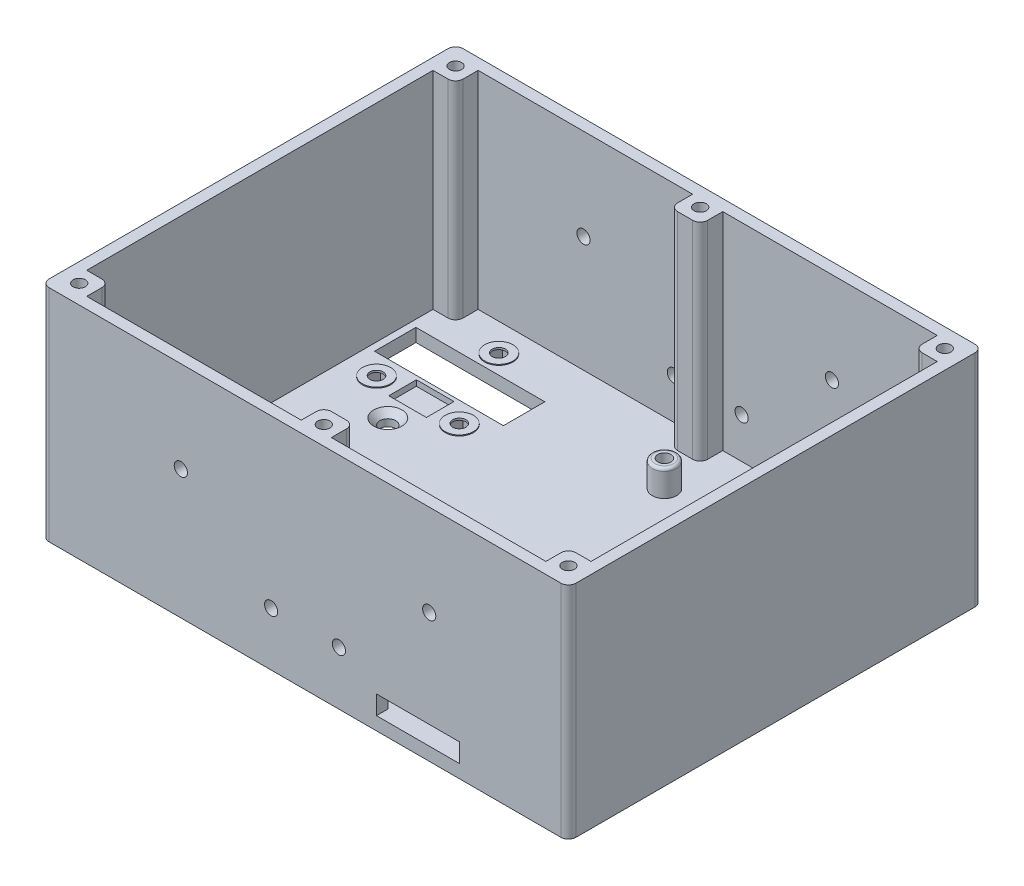
from build123d import *

# Parameters (mm, degrees)
SKETCH1_W                             = 140
SKETCH1_H                             = 110
BOTTOM_DEPTH                          = 3.5
SKETCH3_W                             = 140
SKETCH3_H                             = 110
WALL_DEPTH                            = 55
SKETCH4_R                             = 1.625
TOP_PLATE_SCREW_HOLES_DEPTH           = 30
TOP_PLATE_SCREW_HOLES_DRAFT           = -1
TOP_PLATE_SCREW_HOLES_PROFILE_2_DEPTH = 30
TOP_PLATE_SCREW_HOLES_PROFILE_2_DRAFT = -1
TOP_PLATE_SCREW_HOLES_PROFILE_3_DEPTH = 30
TOP_PLATE_SCREW_HOLES_PROFILE_3_DRAFT = -1
TOP_PLATE_SCREW_HOLES_PROFILE_4_DEPTH = 30
TOP_PLATE_SCREW_HOLES_PROFILE_4_DRAFT = -1
TOP_PLATE_SCREW_HOLES_PROFILE_5_DEPTH = 30
TOP_PLATE_SCREW_HOLES_PROFILE_5_DRAFT = -1
TOP_PLATE_SCREW_HOLES_PROFILE_6_DEPTH = 30
TOP_PLATE_SCREW_HOLES_PROFILE_6_DRAFT = -1
FILLET14_R                            = 2
FILLET13_R                            = 2
FILLET12_R                            = 2
FILLET11_R                            = 2
FILLET1_R                             = 2
FILLET2_R                             = 2
FILLET3_R                             = 2
FILLET4_R                             = 2
FILLET5_R                             = 2
FILLET6_R                             = 2
FILLET7_R                             = 2
FILLET8_R                             = 2
M4_MOUNT_R                            = 2.1
M4_MOUNT_CUT_DEPTH                    = 105.642247682
SKETCH7_R                             = 7.5
USB_CABEL_CUT_DEPTH                   = 107.523471592
FILLET9_R                             = 1
FILLET10_R                            = 1
SKETCH14_W                            = 8
SKETCH14_H                            = 7
BOSS_EXTRUDE1_DEPTH                   = 6
SKETCH16_W                            = 4
SKETCH16_H                            = 3
CUT_EXTRUDE6_DEPTH                    = 7
SKETCH9_R                             = 3.25
CURCUIT_BOARD_MOUNT_POSTS_EXT_DEPTH   = 7
SKETCH10_R                            = 1.75
M3_SCREW_CURCUIT_MOUNT_CUT_DEPTH      = 102.138518874
M3_HEAD_CIRCUIT_MOUNT_CUT_DEPTH       = 3.25
FILLET15_R                            = 0.75
FILLET16_R                            = 0.75
SKETCH18_R                            = 1.75
TOP_SCREW_DEPTH                       = 3
SKETCH19_W                            = 22
SKETCH19_H                            = 5
TOP_CABLES_DEPTH                      = 10
SKETCH20_W                            = 22
SKETCH20_H                            = 5
BOTTOM_CABLES_DEPTH                   = 3
BOTTOM_SCREW_START                    = -3
SKETCH21_R                            = 1.75
BOTTOM_SCREW_DEPTH                    = 3
SKETCH22_W                            = 34.25
SKETCH22_H                            = 11
CONNECTORS_CUT_DEPTH                  = 3.5
SKETCH24_R                            = 3.75
STANDOFFS_DEPTH                       = 0.25
M3_SCREW_HOLE_DEPTH                   = 105.642247682
M3_SCREW_HOLE_DEPTH_BACK              = 105.642247682
SKETCH23_R                            = 1.75
M3_NUT_DEPTH                          = 3.25
SKETCH26_W                            = 10
SKETCH26_H                            = 7.35
ROOM_FOR_PCB_PINS_DEPTH               = 1.5


with BuildPart() as part:
    # Sketch1 → Bottom (new body)
    with BuildSketch(Plane(origin=(0, 0, 0), x_dir=(1, 0, 0), z_dir=(0, 1, 0))):
        Rectangle(SKETCH1_W, SKETCH1_H)
    extrude(amount=BOTTOM_DEPTH)

    # Sketch3 → Wall (add)
    with BuildSketch(Plane(origin=(0, 3.5, 0), x_dir=(1, 0, 0), z_dir=(0, 1, 0))):
        Rectangle(SKETCH3_W, SKETCH3_H)
        Polygon((-61, 52), (-4, 52), (-4, 46), (4, 46), (4, 52), (61, 52), (61, 46), (67, 46), (67, -46), (61, -46), (61, -52), (4, -52), (4, -46), (-4, -46), (-4, -52), (-61, -52), (-61, -46), (-67, -46), (-67, 46), (-61, 46), align=None, mode=Mode.SUBTRACT)
    extrude(amount=WALL_DEPTH)


with BuildPart() as top_plate_screw_holes_tool:
    # Sketch4 → Top Plate Screw Holes (with draft: the straight prism first)
    with BuildSketch(Plane(origin=(0, 58.5, 0), x_dir=(1, 0, 0), z_dir=(0, 1, 0))):
        with Locations((-65, 50)):
            Circle(SKETCH4_R)
    extrude(amount=-TOP_PLATE_SCREW_HOLES_DEPTH)
    # Top Plate Screw Holes: the draft: its side faces are tilted about the plane it starts from
    top_plate_screw_holes_sides = [top_plate_screw_holes_tool.faces().sort_by_distance(p)[0] for p in [
        (-66.625, 43.5, -50),
    ]]
    draft(top_plate_screw_holes_sides, Plane(origin=(0, 58.5, 0), x_dir=(1, 0, 0), z_dir=(0, 1, 0)), TOP_PLATE_SCREW_HOLES_DRAFT)


with BuildPart() as part_1:
    add(part.part)

    # Top Plate Screw Holes: cut by top_plate_screw_holes_tool
    add(top_plate_screw_holes_tool.part, mode=Mode.SUBTRACT)


with BuildPart() as top_plate_screw_holes_profile_2_tool:
    # Sketch4 → Top Plate Screw Holes profile 2 (with draft: the straight prism first)
    with BuildSketch(Plane(origin=(0, 58.5, 0), x_dir=(1, 0, 0), z_dir=(0, 1, 0))):
        with Locations((65, 50)):
            Circle(SKETCH4_R)
    extrude(amount=-TOP_PLATE_SCREW_HOLES_PROFILE_2_DEPTH)
    # Top Plate Screw Holes profile 2: the draft: its side faces are tilted about the plane it starts from
    top_plate_screw_holes_profile_2_sides = [top_plate_screw_holes_profile_2_tool.faces().sort_by_distance(p)[0] for p in [
        (63.375, 43.5, -50),
    ]]
    draft(top_plate_screw_holes_profile_2_sides, Plane(origin=(0, 58.5, 0), x_dir=(1, 0, 0), z_dir=(0, 1, 0)), TOP_PLATE_SCREW_HOLES_PROFILE_2_DRAFT)


with BuildPart() as part_2:
    add(part_1.part)

    # Top Plate Screw Holes profile 2: cut by top_plate_screw_holes_profile_2_tool
    add(top_plate_screw_holes_profile_2_tool.part, mode=Mode.SUBTRACT)


with BuildPart() as top_plate_screw_holes_profile_3_tool:
    # Sketch4 → Top Plate Screw Holes profile 3 (with draft: the straight prism first)
    with BuildSketch(Plane(origin=(0, 58.5, 0), x_dir=(1, 0, 0), z_dir=(0, 1, 0))):
        with Locations((65, -50)):
            Circle(SKETCH4_R)
    extrude(amount=-TOP_PLATE_SCREW_HOLES_PROFILE_3_DEPTH)
    # Top Plate Screw Holes profile 3: the draft: its side faces are tilted about the plane it starts from
    top_plate_screw_holes_profile_3_sides = [top_plate_screw_holes_profile_3_tool.faces().sort_by_distance(p)[0] for p in [
        (63.375, 43.5, 50),
    ]]
    draft(top_plate_screw_holes_profile_3_sides, Plane(origin=(0, 58.5, 0), x_dir=(1, 0, 0), z_dir=(0, 1, 0)), TOP_PLATE_SCREW_HOLES_PROFILE_3_DRAFT)


with BuildPart() as part_3:
    add(part_2.part)

    # Top Plate Screw Holes profile 3: cut by top_plate_screw_holes_profile_3_tool
    add(top_plate_screw_holes_profile_3_tool.part, mode=Mode.SUBTRACT)


with BuildPart() as top_plate_screw_holes_profile_4_tool:
    # Sketch4 → Top Plate Screw Holes profile 4 (with draft: the straight prism first)
    with BuildSketch(Plane(origin=(0, 58.5, 0), x_dir=(1, 0, 0), z_dir=(0, 1, 0))):
        with Locations((-65, -50)):
            Circle(SKETCH4_R)
    extrude(amount=-TOP_PLATE_SCREW_HOLES_PROFILE_4_DEPTH)
    # Top Plate Screw Holes profile 4: the draft: its side faces are tilted about the plane it starts from
    top_plate_screw_holes_profile_4_sides = [top_plate_screw_holes_profile_4_tool.faces().sort_by_distance(p)[0] for p in [
        (-66.625, 43.5, 50),
    ]]
    draft(top_plate_screw_holes_profile_4_sides, Plane(origin=(0, 58.5, 0), x_dir=(1, 0, 0), z_dir=(0, 1, 0)), TOP_PLATE_SCREW_HOLES_PROFILE_4_DRAFT)


with BuildPart() as part_4:
    add(part_3.part)

    # Top Plate Screw Holes profile 4: cut by top_plate_screw_holes_profile_4_tool
    add(top_plate_screw_holes_profile_4_tool.part, mode=Mode.SUBTRACT)


with BuildPart() as top_plate_screw_holes_profile_5_tool:
    # Sketch4 → Top Plate Screw Holes profile 5 (with draft: the straight prism first)
    with BuildSketch(Plane(origin=(0, 58.5, 0), x_dir=(1, 0, 0), z_dir=(0, 1, 0))):
        with Locations((0, 50)):
            Circle(SKETCH4_R)
    extrude(amount=-TOP_PLATE_SCREW_HOLES_PROFILE_5_DEPTH)
    # Top Plate Screw Holes profile 5: the draft: its side faces are tilted about the plane it starts from
    top_plate_screw_holes_profile_5_sides = [top_plate_screw_holes_profile_5_tool.faces().sort_by_distance(p)[0] for p in [
        (-1.625, 43.5, -50),
    ]]
    draft(top_plate_screw_holes_profile_5_sides, Plane(origin=(0, 58.5, 0), x_dir=(1, 0, 0), z_dir=(0, 1, 0)), TOP_PLATE_SCREW_HOLES_PROFILE_5_DRAFT)


with BuildPart() as part_5:
    add(part_4.part)

    # Top Plate Screw Holes profile 5: cut by top_plate_screw_holes_profile_5_tool
    add(top_plate_screw_holes_profile_5_tool.part, mode=Mode.SUBTRACT)


with BuildPart() as top_plate_screw_holes_profile_6_tool:
    # Sketch4 → Top Plate Screw Holes profile 6 (with draft: the straight prism first)
    with BuildSketch(Plane(origin=(0, 58.5, 0), x_dir=(1, 0, 0), z_dir=(0, 1, 0))):
        with Locations((0, -50)):
            Circle(SKETCH4_R)
    extrude(amount=-TOP_PLATE_SCREW_HOLES_PROFILE_6_DEPTH)
    # Top Plate Screw Holes profile 6: the draft: its side faces are tilted about the plane it starts from
    top_plate_screw_holes_profile_6_sides = [top_plate_screw_holes_profile_6_tool.faces().sort_by_distance(p)[0] for p in [
        (-1.625, 43.5, 50),
    ]]
    draft(top_plate_screw_holes_profile_6_sides, Plane(origin=(0, 58.5, 0), x_dir=(1, 0, 0), z_dir=(0, 1, 0)), TOP_PLATE_SCREW_HOLES_PROFILE_6_DRAFT)


with BuildPart() as part_6:
    add(part_5.part)

    # Top Plate Screw Holes profile 6: cut by top_plate_screw_holes_profile_6_tool
    add(top_plate_screw_holes_profile_6_tool.part, mode=Mode.SUBTRACT)

    # Fillet14
    fillet14_edges = [part_6.edges().sort_by_distance(p)[0] for p in [
        (-4, 31, 46),
    ]]
    fillet(fillet14_edges, radius=FILLET14_R)

    # Fillet13
    fillet13_edges = [part_6.edges().sort_by_distance(p)[0] for p in [
        (4, 31, 46),
    ]]
    fillet(fillet13_edges, radius=FILLET13_R)

    # Fillet12
    fillet12_edges = [part_6.edges().sort_by_distance(p)[0] for p in [
        (-4, 31, -46),
    ]]
    fillet(fillet12_edges, radius=FILLET12_R)

    # Fillet11
    fillet11_edges = [part_6.edges().sort_by_distance(p)[0] for p in [
        (4, 31, -46),
    ]]
    fillet(fillet11_edges, radius=FILLET11_R)

    # Fillet1
    fillet1_edges = [part_6.edges().sort_by_distance(p)[0] for p in [
        (-61, 31, 46),
    ]]
    fillet(fillet1_edges, radius=FILLET1_R)

    # Fillet2
    fillet2_edges = [part_6.edges().sort_by_distance(p)[0] for p in [
        (61, 31, 46),
    ]]
    fillet(fillet2_edges, radius=FILLET2_R)

    # Fillet3
    fillet3_edges = [part_6.edges().sort_by_distance(p)[0] for p in [
        (61, 31, -46),
    ]]
    fillet(fillet3_edges, radius=FILLET3_R)

    # Fillet4
    fillet4_edges = [part_6.edges().sort_by_distance(p)[0] for p in [
        (-61, 31, -46),
    ]]
    fillet(fillet4_edges, radius=FILLET4_R)

    # Fillet5
    fillet5_edges = [part_6.edges().sort_by_distance(p)[0] for p in [
        (-70, 29.25, -55),
    ]]
    fillet(fillet5_edges, radius=FILLET5_R)

    # Fillet6
    fillet6_edges = [part_6.edges().sort_by_distance(p)[0] for p in [
        (70, 29.25, -55),
    ]]
    fillet(fillet6_edges, radius=FILLET6_R)

    # Fillet7
    fillet7_edges = [part_6.edges().sort_by_distance(p)[0] for p in [
        (70, 29.25, 55),
    ]]
    fillet(fillet7_edges, radius=FILLET7_R)

    # Fillet8
    fillet8_edges = [part_6.edges().sort_by_distance(p)[0] for p in [
        (-70, 29.25, 55),
    ]]
    fillet(fillet8_edges, radius=FILLET8_R)

    # M4 Mount → M4 Mount Cut (cut, through all)
    with BuildSketch(Plane.XZ.offset(-3.5)):
        with Locations(Location((48, -15, 0), (0, 0, 270))):
            Circle(M4_MOUNT_R)
        with Locations(Location((48, 20, 0), (0, 0, 270))):
            Circle(M4_MOUNT_R)
        with Locations(Location((-48, 20, 0), (0, 0, 90))):
            Circle(M4_MOUNT_R)
        with Locations(Location((-48, -15, 0), (0, 0, 90))):
            Circle(M4_MOUNT_R)
    extrude(amount=M4_MOUNT_CUT_DEPTH, mode=Mode.SUBTRACT)

    # Cut-Extrude3 cone 1 section (through the dimple's axis) → Cut-Extrude3 (revolve, cut)
    with BuildSketch(Plane(origin=(48, 3.5, 20), x_dir=(0, 0, 1), z_dir=(1, 0, 0))):
        Polygon((0, 0), (3.75, 0), (0, 3.75), align=None)
    revolve(axis=Axis((48, 3.5, 20), (0, -1, 0)), mode=Mode.SUBTRACT)

    # Cut-Extrude3 cone 2 section (through the dimple's axis) → Cut-Extrude3 cone 2 (revolve, cut)
    with BuildSketch(Plane(origin=(48, 3.5, -15), x_dir=(0, 0, 1), z_dir=(1, 0, 0))):
        Polygon((0, 0), (3.75, 0), (0, 3.75), align=None)
    revolve(axis=Axis((48, 3.5, -15), (0, -1, 0)), mode=Mode.SUBTRACT)

    # Cut-Extrude3 cone 3 section (through the dimple's axis) → Cut-Extrude3 cone 3 (revolve, cut)
    with BuildSketch(Plane(origin=(-48, 3.5, -15), x_dir=(0, 0, 1), z_dir=(1, 0, 0))):
        Polygon((0, 0), (3.75, 0), (0, 3.75), align=None)
    revolve(axis=Axis((-48, 3.5, -15), (0, -1, 0)), mode=Mode.SUBTRACT)

    # Cut-Extrude3 cone 4 section (through the dimple's axis) → Cut-Extrude3 cone 4 (revolve, cut)
    with BuildSketch(Plane(origin=(-48, 3.5, 20), x_dir=(0, 0, 1), z_dir=(1, 0, 0))):
        Polygon((0, 0), (3.75, 0), (0, 3.75), align=None)
    revolve(axis=Axis((-48, 3.5, 20), (0, -1, 0)), mode=Mode.SUBTRACT)

    # Sketch7 → USB Cabel Cut (cut, through all)
    with BuildSketch(Plane.XZ):
        with Locations(Location((41, -32, 0), (0, 0, 270))):
            Circle(SKETCH7_R)
    extrude(amount=-USB_CABEL_CUT_DEPTH, mode=Mode.SUBTRACT)

    # Fillet9
    fillet9_edges = [part_6.edges().sort_by_distance(p)[0] for p in [
        (41, 0, -24.5),
    ]]
    fillet(fillet9_edges, radius=FILLET9_R)

    # Fillet10
    fillet10_edges = [part_6.edges().sort_by_distance(p)[0] for p in [
        (41, 3.5, -24.5),
    ]]
    fillet(fillet10_edges, radius=FILLET10_R)

    # Sketch14 → Boss-Extrude1 (add)
    with BuildSketch(Plane(origin=(0, 3.5, 0), x_dir=(1, 0, 0), z_dir=(0, 1, 0))):
        with Locations((55, 33.5)):
            Rectangle(SKETCH14_W, SKETCH14_H)
    extrude(amount=BOSS_EXTRUDE1_DEPTH)

    # Sketch16 → Cut-Extrude6 (cut)
    with BuildSketch(Plane(origin=(18.18080474, 0, -30), x_dir=(-1, 0, 0), z_dir=(0, 0, -1))):
        with Locations((-36.81919526, 5)):
            Rectangle(SKETCH16_W, SKETCH16_H)
    extrude(amount=CUT_EXTRUDE6_DEPTH, mode=Mode.SUBTRACT)

    # Sketch9 → Curcuit Board Mount Posts EXT (add)
    with BuildSketch(Plane(origin=(0, 3.5, 0), x_dir=(1, 0, 0), z_dir=(0, 1, 0))):
        with Locations(Location((-6, -39, 0), (0, 0, 270))):
            Circle(SKETCH9_R)
        with Locations(Location((5, 35.5, 0), (0, 0, 270))):
            Circle(SKETCH9_R)
    extrude(amount=CURCUIT_BOARD_MOUNT_POSTS_EXT_DEPTH)

    # Sketch10 → M3 Screw Curcuit Mount CUT (cut, through all)
    with BuildSketch(Plane(origin=(0, 10.5, 0), x_dir=(1, 0, 0), z_dir=(0, 1, 0))):
        with Locations(Location((5, 35.5, 0), (0, 0, 270))):
            Circle(SKETCH10_R)
        with Locations(Location((-6, -39, 0), (0, 0, 270))):
            Circle(SKETCH10_R)
    extrude(amount=-M3_SCREW_CURCUIT_MOUNT_CUT_DEPTH, mode=Mode.SUBTRACT)

    # Sketch11 → M3 Head Circuit Mount CUT (cut)
    with BuildSketch(Plane.XZ):
        Polygon((-8.663882325, 38.317188929), (-6.740609429, 36.351604698), (-4.076727104, 37.034415769), (-3.336117675, 39.682811071), (-5.259390571, 41.648395302), (-7.923272896, 40.965584231), align=None)
        Polygon((5, -38.675426481), (7.75, -37.08771324), (7.75, -33.91228676), (5, -32.324573519), (2.25, -33.91228676), (2.25, -37.08771324), align=None)
    extrude(amount=-M3_HEAD_CIRCUIT_MOUNT_CUT_DEPTH, mode=Mode.SUBTRACT)

    # Fillet15
    fillet15_edges = [part_6.edges().sort_by_distance(p)[0] for p in [
        (5, 10.5, -38.75),
    ]]
    fillet(fillet15_edges, radius=FILLET15_R)

    # Fillet16
    fillet16_edges = [part_6.edges().sort_by_distance(p)[0] for p in [
        (-6, 10.5, 35.75),
    ]]
    fillet(fillet16_edges, radius=FILLET16_R)

    # Sketch18 → TOP-Screw (cut)
    with BuildSketch(Plane(origin=(0, 0, -55), x_dir=(-1, 0, 0), z_dir=(0, 0, -1))):
        with Locations((-33, 34.25)):
            Circle(SKETCH18_R)
        with Locations((33, 34.25)):
            Circle(SKETCH18_R)
        with Locations((-9, 14.25)):
            Circle(SKETCH18_R)
        with Locations(Location((9, 14.25, 0), (0, 0, 180))):
            Circle(SKETCH18_R)
    extrude(amount=-TOP_SCREW_DEPTH, mode=Mode.SUBTRACT)

    # Sketch19 → TOP-Cables (cut)
    with BuildSketch(Plane.XY.offset(-52)):
        with Locations((30, 6)):
            Rectangle(SKETCH19_W, SKETCH19_H)
    extrude(amount=-TOP_CABLES_DEPTH, mode=Mode.SUBTRACT)

    # Sketch20 → Bottom-Cables (cut)
    with BuildSketch(Plane.XY.offset(55)):
        with Locations((30, 6)):
            Rectangle(SKETCH20_W, SKETCH20_H)
    extrude(amount=-BOTTOM_CABLES_DEPTH, mode=Mode.SUBTRACT)

    # Sketch21 → Bottom-Screw (cut)
    with BuildSketch(Plane.XY.offset(55).offset(BOTTOM_SCREW_START)):
        with Locations(Location((-33, 34.25, 0), (0, 0, 180))):
            Circle(SKETCH21_R)
        with Locations((-9, 14.25)):
            Circle(SKETCH21_R)
        with Locations(Location((9, 14.25, 0), (0, 0, 180))):
            Circle(SKETCH21_R)
        with Locations(Location((33, 34.25, 0), (0, 0, 180))):
            Circle(SKETCH21_R)
    extrude(amount=BOTTOM_SCREW_DEPTH, mode=Mode.SUBTRACT)

    # Sketch22 → Connectors Cut (cut)
    with BuildSketch(Plane(origin=(0, 3.5, 0), x_dir=(1, 0, 0), z_dir=(0, 1, 0))):
        with Locations((-48, 34.1)):
            Rectangle(SKETCH22_W, SKETCH22_H)
    extrude(amount=-CONNECTORS_CUT_DEPTH, mode=Mode.SUBTRACT)

    # Sketch24 → Standoffs (add)
    with BuildSketch(Plane(origin=(0, 3.5, 0), x_dir=(1, 0, 0), z_dir=(0, 1, 0))):
        with Locations(Location((-59, 23, 0), (0, 0, 270))):
            Circle(SKETCH24_R)
        with Locations(Location((-48, 44.5, 0), (0, 0, 270))):
            Circle(SKETCH24_R)
        with Locations(Location((-37, 23, 0), (0, 0, 270))):
            Circle(SKETCH24_R)
    extrude(amount=STANDOFFS_DEPTH)

    # Sketch23 → M3 Screw Hole (cut, two sides: drawn at the far end of the back side and taken through both)
    with BuildSketch(Plane(origin=(0, 3.5, 0), x_dir=(1, 0, 0), z_dir=(0, 1, 0)).offset(-M3_SCREW_HOLE_DEPTH_BACK)):
        with Locations(Location((-48, 44.5, 0), (0, 0, 270))):
            Circle(SKETCH23_R)
        with Locations(Location((-37, 23, 0), (0, 0, 270))):
            Circle(SKETCH23_R)
        with Locations(Location((-59, 23, 0), (0, 0, 270))):
            Circle(SKETCH23_R)
    extrude(amount=M3_SCREW_HOLE_DEPTH + M3_SCREW_HOLE_DEPTH_BACK, mode=Mode.SUBTRACT)

    # Sketch25 → M3 Nut (cut)
    with BuildSketch(Plane.XZ):
        Polygon((-39.75, -23), (-38.375, -25.38156986), (-35.625, -25.38156986), (-34.25, -23), (-35.625, -20.61843014), (-38.375, -20.61843014), align=None)
        Polygon((-60.375, -25.38156986), (-57.625, -25.38156986), (-56.25, -23), (-57.625, -20.61843014), (-60.375, -20.61843014), (-61.75, -23), align=None)
        Polygon((-49.375, -46.88156986), (-46.625, -46.88156986), (-45.25, -44.5), (-46.625, -42.11843014), (-49.375, -42.11843014), (-50.75, -44.5), align=None)
    extrude(amount=-M3_NUT_DEPTH, mode=Mode.SUBTRACT)

    # Sketch26 → Room for PCB pins (cut)
    with BuildSketch(Plane(origin=(0, 3.5, 0), x_dir=(1, 0, 0), z_dir=(0, 1, 0))):
        with Locations((-48, 23.925)):
            Rectangle(SKETCH26_W, SKETCH26_H)
    extrude(amount=-ROOM_FOR_PCB_PINS_DEPTH, mode=Mode.SUBTRACT)


solid = part_6.part
